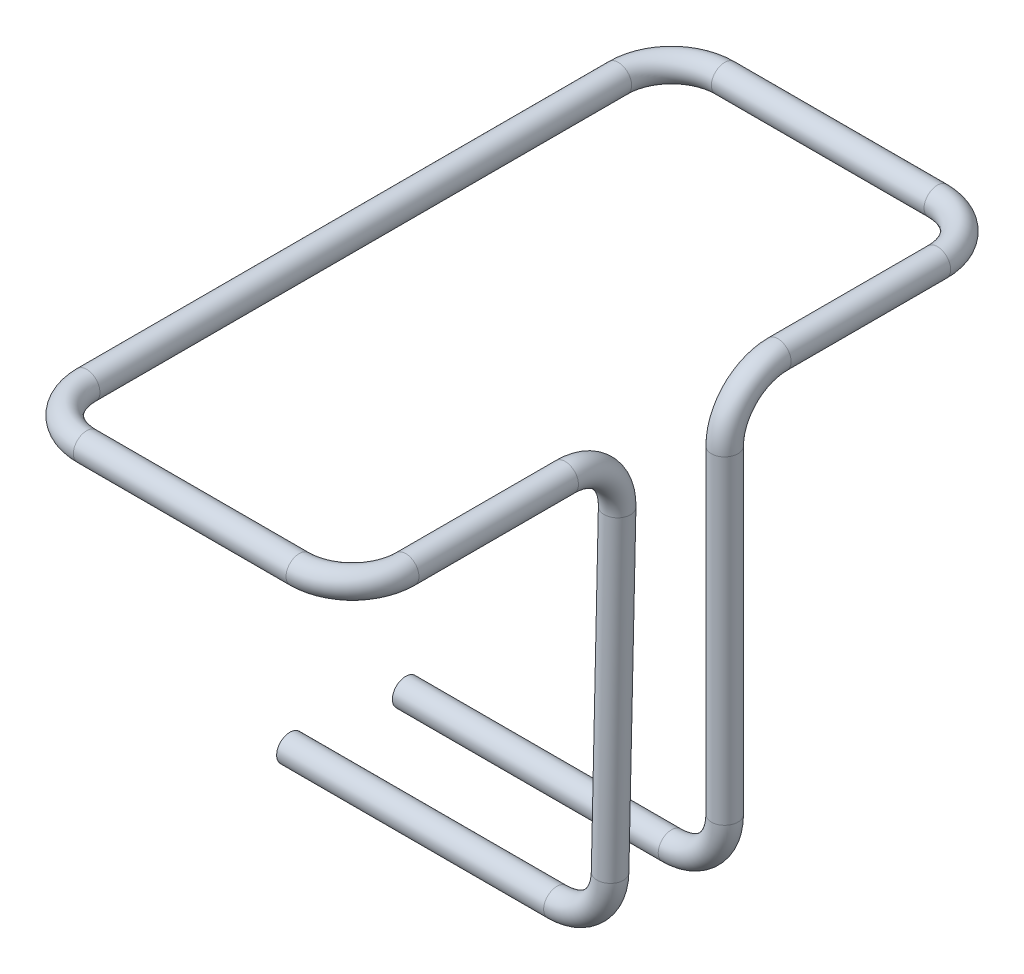
from build123d import *

# Parameters (mm, degrees)
SKETCH1_R = 0.125


with BuildPart() as part:
    # Sweep1: sweep along a curve in space
    with BuildLine() as sweep1_path:
        Line((0, 0, 0), (2.510924284, 0, 0))
        ThreePointArc((2.510924284, 0, 0), (2.860551373, 0.142563434, 0), (3.010802308, 0.488956405, 0))
        Line((3.010802308, 0.488956405, 0), (3.077305162, 3.499146169, 0))
        ThreePointArc((3.077305162, 3.499146169, 0), (3.085114163, 3.85261331, 0.146446609), (3.088348757, 3.999024193, 0.5))
        Line((3.088348757, 3.999024193, 0.5), (3.088348757, 3.999024193, 2))
        ThreePointArc((3.088348757, 3.999024193, 2), (2.941902147, 3.999024193, 2.353553391), (2.588348757, 3.999024193, 2.5))
        Line((2.588348757, 3.999024193, 2.5), (0.588348757, 3.999024193, 2.5))
        ThreePointArc((0.588348757, 3.999024193, 2.5), (0.234795366, 3.999024193, 2.353553391), (0.088348757, 3.999024193, 2))
        Line((0.088348757, 3.999024193, 2), (0.088348757, 3.999024193, -3))
        ThreePointArc((0.088348757, 3.999024193, -3), (0.234795366, 3.999024193, -3.353553391), (0.588348757, 3.999024193, -3.5))
        Line((0.588348757, 3.999024193, -3.5), (2.588348757, 3.999024193, -3.5))
        ThreePointArc((2.588348757, 3.999024193, -3.5), (2.941902147, 3.999024193, -3.353553391), (3.088348757, 3.999024193, -3))
        Line((3.088348757, 3.999024193, -3), (3.088348757, 3.999024193, -1.5))
        ThreePointArc((3.088348757, 3.999024193, -1.5), (3.088348757, 3.852577584, -1.146446609), (3.088348757, 3.499024193, -1))
        Line((3.088348757, 3.499024193, -1), (3.088348757, 0.499024193, -1))
        ThreePointArc((3.088348757, 0.499024193, -1), (2.941902147, 0.145470803, -1), (2.588348757, -0.000975807, -1))
        Line((2.588348757, -0.000975807, -1), (0.088348757, -0.000975807, -1))
    # Sketch1 → Sweep1 (sweep)
    with BuildSketch(Plane(origin=(0, 0, 0), x_dir=(0, 0, -1), z_dir=(1, 0, 0))):
        Circle(SKETCH1_R)
    sweep(path=sweep1_path.line)


solid = part.part
